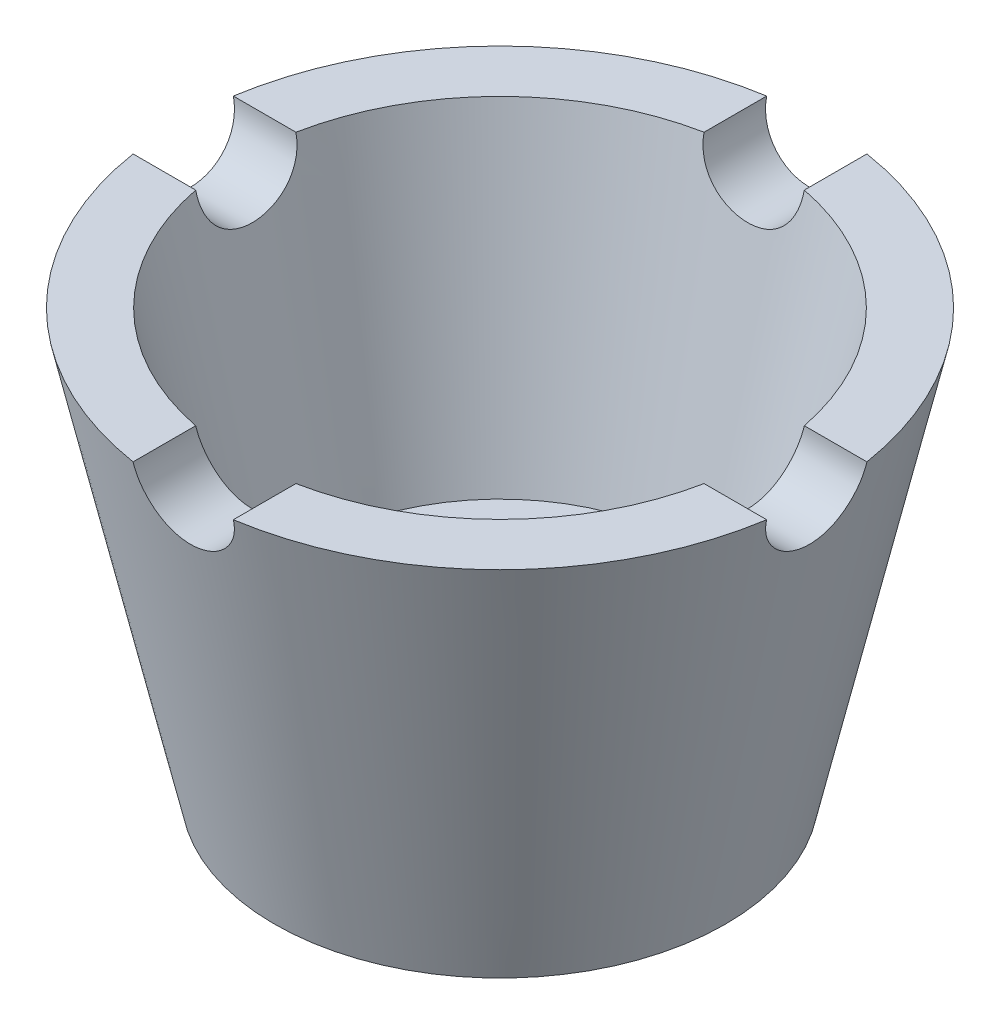
from build123d import *

# Parameters (mm, degrees)
CUT_EXTRUDE1_START = -10
CUT_EXTRUDE1_DEPTH = 72.741396162
CIRPATTERN1_COUNT  = 4


with BuildPart() as part:
    # Sketch1 → Revolve1 (revolve)
    with BuildSketch(Plane.XY, mode=Mode.PRIVATE) as revolve1_sk:
        Polygon((11.25, 0), (11.25, 12), (19.062713823, 12), (25.848428109, 42), (32, 42), (22.5, 0), align=None)
    revolve(revolve1_sk.sketch.rotate(Axis((0, 0, 0), (0, 1, 0)), 90), axis=Axis((0, 0, 0), (0, 1, 0)))

    # Sketch2 → Cut-Extrude1 (cut)
    with BuildSketch(Plane.XY.offset(CUT_EXTRUDE1_START)):
        with BuildLine():
            Line((5, 42), (-5, 42))
            ThreePointArc((-5, 42), (0, 37), (5, 42))
        make_face()
    cut_extrude1 = extrude(amount=CUT_EXTRUDE1_DEPTH, mode=Mode.SUBTRACT)

    # CirPattern1: Cut-Extrude1 ×4 about axis
    cirpattern1_axis = Axis((0, 42, 0), (0, -1, 0))
    for i in range(1, CIRPATTERN1_COUNT):
        add(cut_extrude1.rotate(cirpattern1_axis, i * 360 / CIRPATTERN1_COUNT), mode=Mode.SUBTRACT)


solid = part.part
